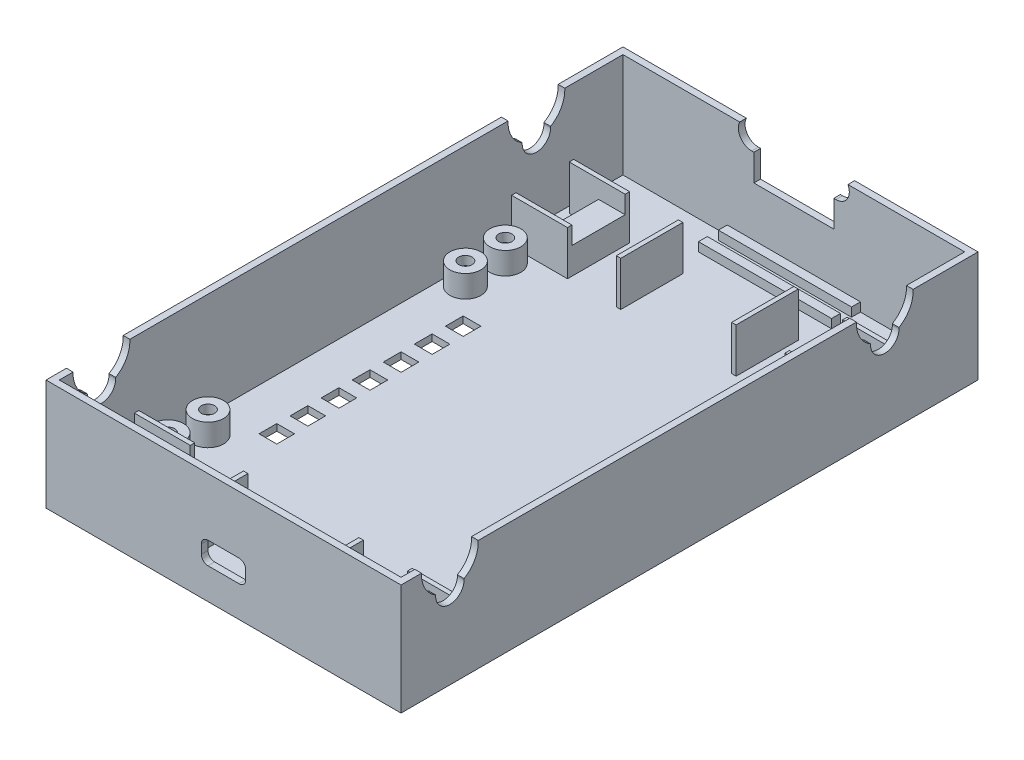
from build123d import *

# Parameters (mm, degrees)
SKETCH_265_W         = 80
SKETCH_265_H         = 130
EXTRUDE_1_DEPTH      = 25
SKETCH_1_W           = 77
SKETCH_1_H           = 127
CUT_EXTRUDE_1_DEPTH  = 23.5
CUT_EXTRUDE_2_DEPTH  = 2
CUT_EXTRUDE_3_DEPTH  = 1.5
CUT_EXTRUDE_4_DEPTH  = 1.5
CUT_EXTRUDE_START    = -1.5
CUT_EXTRUDE_5_DEPTH  = 1.5
CUT_EXTRUDE_7_DEPTH  = 1.5
SKETCH_10_W          = 6
SKETCH_10_H          = 12
EXTRUDE_2_DEPTH      = 6
SKETCH_11_W          = 12.6
SKETCH_11_H          = 1
EXTRUDE_3_DEPTH      = 10
SKETCH_13_R          = 3.5
EXTRUDE_4_DEPTH      = 5
SKETCH_14_R          = 2.5
CUT_EXTRUDE_8_DEPTH  = 4.5
CUT_EXTRUDE_9_REACH  = 80.532
SKETCH_15_R          = 1.5
FILLET_1_R           = 1
CUT_EXTRUDE_10_REACH = 81.858
SKETCH_16_W          = 4
SKETCH_16_H          = 4
CUT_EXTRUDE_12_DEPTH = 1.5
SKETCH_18_W          = 30
SKETCH_18_H          = 2
EXTRUDE_5_DEPTH      = 2
SKETCH_19_W          = 1
SKETCH_19_H          = 14
EXTRUDE_6_DEPTH      = 10


with BuildPart() as part:
    # Sketch 265 → Бобышка-Вытянуть1 (new body)
    with BuildSketch(Plane(origin=(0, 0, 0), x_dir=(1, 0, 0), z_dir=(0, 1, 0))):
        Rectangle(SKETCH_265_W, SKETCH_265_H)
    extrude(amount=EXTRUDE_1_DEPTH)

    # Эскиз1 → Вырез-Вытянуть1 (cut)
    with BuildSketch(Plane(origin=(0, 25, 0), x_dir=(1, 0, 0), z_dir=(0, 1, 0))):
        Rectangle(SKETCH_1_W, SKETCH_1_H)
    extrude(amount=-CUT_EXTRUDE_1_DEPTH, mode=Mode.SUBTRACT)

    # Эскиз2 → Вырез-Вытянуть2 (cut)
    with BuildSketch(Plane.XY.offset(-63.5)):
        with BuildLine():
            Line((-9, 26.7), (-9, 32.7))
            Line((-9, 32.7), (9, 32.7))
            Line((9, 32.7), (9, 26.7))
            Line((9, 26.7), (9.5, 26.7))
            ThreePointArc((9.5, 26.7), (12.5, 23.7), (9.5, 20.7))
            Line((9.5, 20.7), (9, 20.7))
            Line((9, 20.7), (9, 14.7))
            Line((9, 14.7), (-9, 14.7))
            Line((-9, 14.7), (-9, 20.7))
            Line((-9, 20.7), (-9.5, 20.7))
            ThreePointArc((-9.5, 20.7), (-12.5, 23.7), (-9.5, 26.7))
            Line((-9.5, 26.7), (-9, 26.7))
        make_face()
    extrude(amount=-CUT_EXTRUDE_2_DEPTH, mode=Mode.SUBTRACT)

    # Эскиз3 → Вырез-Вытянуть3 (cut)
    with BuildSketch(Plane.ZY.offset(40)):
        with BuildLine():
            Line((-47.2, 18.9), (-47.2, 19.157437416))
            ThreePointArc((-47.2, 19.157437416), (-44, 31.1), (-40.8, 19.157437416))
            Line((-40.8, 19.157437416), (-40.8, 18.9))
            ThreePointArc((-40.8, 18.9), (-44, 15.7), (-47.2, 18.9))
        make_face()
    extrude(amount=-CUT_EXTRUDE_3_DEPTH, mode=Mode.SUBTRACT)

    # Эскиз5 → Вырез-Вытянуть4 (cut)
    with BuildSketch(Plane.ZY.offset(40)):
        with BuildLine():
            Line((50.8, 18.9), (50.8, 19.157437416))
            ThreePointArc((50.8, 19.157437416), (54, 31.1), (57.2, 19.157437416))
            Line((57.2, 19.157437416), (57.2, 18.9))
            ThreePointArc((57.2, 18.9), (54, 15.7), (50.8, 18.9))
        make_face()
    extrude(amount=-CUT_EXTRUDE_4_DEPTH, mode=Mode.SUBTRACT)

    # Эскиз6 → Вырез-Вытянуть5 (cut)
    with BuildSketch(Plane(origin=(40, 0, 0), x_dir=(0, 0, -1), z_dir=(1, 0, 0)).offset(CUT_EXTRUDE_START)):
        with BuildLine():
            Line((-57.2, 18.9), (-57.2, 19.157437416))
            ThreePointArc((-57.2, 19.157437416), (-54, 31.1), (-50.8, 19.157437416))
            Line((-50.8, 19.157437416), (-50.8, 18.9))
            ThreePointArc((-50.8, 18.9), (-54, 15.7), (-57.2, 18.9))
        make_face()
    extrude(amount=CUT_EXTRUDE_5_DEPTH, mode=Mode.SUBTRACT)

    # Эскиз9 → Вырез-Вытянуть7 (cut)
    with BuildSketch(Plane(origin=(40, 0, 0), x_dir=(0, 0, -1), z_dir=(1, 0, 0)).offset(CUT_EXTRUDE_START)):
        with BuildLine():
            Line((40.8, 18.9), (40.8, 19.157437416))
            ThreePointArc((40.8, 19.157437416), (44, 31.1), (47.2, 19.157437416))
            Line((47.2, 19.157437416), (47.2, 18.9))
            ThreePointArc((47.2, 18.9), (44, 15.7), (40.8, 18.9))
        make_face()
    extrude(amount=CUT_EXTRUDE_7_DEPTH, mode=Mode.SUBTRACT)

    # Эскиз10 → Бобышка-Вытянуть2 (add)
    with BuildSketch(Plane(origin=(0, 1.5, 0), x_dir=(1, 0, 0), z_dir=(0, 1, 0))):
        with Locations((-27.5, 44)):
            Rectangle(SKETCH_10_W, SKETCH_10_H)
        with Locations((27.5, 44)):
            Rectangle(SKETCH_10_W, SKETCH_10_H)
        with Locations((-27.5, -54)):
            Rectangle(SKETCH_10_W, SKETCH_10_H)
        with Locations((27.5, -54)):
            Rectangle(SKETCH_10_W, SKETCH_10_H)
    extrude(amount=EXTRUDE_2_DEPTH)

    # Эскиз11 → Бобышка-Вытянуть3 (add)
    with BuildSketch(Plane(origin=(0, 1.5, 0), x_dir=(1, 0, 0), z_dir=(0, 1, 0))):
        with Locations((-30.8, 50.5)):
            Rectangle(SKETCH_11_W, SKETCH_11_H)
        with Locations((30.8, 50.5)):
            Rectangle(SKETCH_11_W, SKETCH_11_H)
        with Locations((-30.8, 37.5)):
            Rectangle(SKETCH_11_W, SKETCH_11_H)
        with Locations((30.8, 37.5)):
            Rectangle(SKETCH_11_W, SKETCH_11_H)
        with Locations((30.8, -47.5)):
            Rectangle(SKETCH_11_W, SKETCH_11_H)
        with Locations((30.8, -60.5)):
            Rectangle(SKETCH_11_W, SKETCH_11_H)
        with Locations((-30.8, -47.5)):
            Rectangle(SKETCH_11_W, SKETCH_11_H)
        with Locations((-30.8, -60.5)):
            Rectangle(SKETCH_11_W, SKETCH_11_H)
    extrude(amount=EXTRUDE_3_DEPTH)

    # Эскиз13 → Бобышка-Вытянуть4 (add)
    with BuildSketch(Plane(origin=(0, 1.5, 0), x_dir=(1, 0, 0), z_dir=(0, 1, 0))):
        with Locations(Location((-34.5, 24, 0), (0, 0, 270))):
            Circle(SKETCH_13_R)
        with Locations(Location((34.5, 24, 0), (0, 0, 270))):
            Circle(SKETCH_13_R)
        with Locations(Location((-34.5, -34, 0), (0, 0, 270))):
            Circle(SKETCH_13_R)
        with Locations(Location((34.5, -34, 0), (0, 0, 270))):
            Circle(SKETCH_13_R)
        with Locations(Location((-34.5, 33, 0), (0, 0, 270))):
            Circle(SKETCH_13_R)
        with Locations(Location((34.5, 33, 0), (0, 0, 270))):
            Circle(SKETCH_13_R)
        with Locations(Location((-34.5, -43, 0), (0, 0, 270))):
            Circle(SKETCH_13_R)
        with Locations(Location((34.5, -43, 0), (0, 0, 270))):
            Circle(SKETCH_13_R)
        with Locations(Location((0, -54, 0), (0, 0, 270))):
            Circle(SKETCH_13_R)
    extrude(amount=EXTRUDE_4_DEPTH)

    # Эскиз14 → Вырез-Вытянуть8 (cut)
    with BuildSketch(Plane.XZ):
        with Locations(Location((-34.5, 34, 0), (0, 0, 270))):
            Circle(SKETCH_14_R)
        with Locations(Location((34.5, 34, 0), (0, 0, 270))):
            Circle(SKETCH_14_R)
        with Locations(Location((-34.5, -24, 0), (0, 0, 270))):
            Circle(SKETCH_14_R)
        with Locations(Location((34.5, -24, 0), (0, 0, 270))):
            Circle(SKETCH_14_R)
        with Locations(Location((-34.5, -33, 0), (0, 0, 270))):
            Circle(SKETCH_14_R)
        with Locations(Location((34.5, -33, 0), (0, 0, 270))):
            Circle(SKETCH_14_R)
        with Locations(Location((34.5, 43, 0), (0, 0, 270))):
            Circle(SKETCH_14_R)
        with Locations(Location((-34.5, 43, 0), (0, 0, 270))):
            Circle(SKETCH_14_R)
        with Locations(Location((0, 54, 0), (0, 0, 270))):
            Circle(SKETCH_14_R)
    extrude(amount=-CUT_EXTRUDE_8_DEPTH, mode=Mode.SUBTRACT)

    # Эскиз15 → Вырез-Вытянуть9 (cut, up to next)
    with BuildSketch(Plane(origin=(0, 6.5, 0), x_dir=(1, 0, 0), z_dir=(0, 1, 0)), mode=Mode.PRIVATE) as cut_extrude_9_sk1:
        with Locations(Location((-34.5, 24, 0), (0, 0, 270))):
            Circle(SKETCH_15_R)
    cut_extrude_9_tool1 = extrude(cut_extrude_9_sk1.sketch, amount=-CUT_EXTRUDE_9_REACH, mode=Mode.PRIVATE) & part.part
    # Эскиз15 → Вырез-Вытянуть9 (cut, up to next)
    with BuildSketch(Plane(origin=(0, 6.5, 0), x_dir=(1, 0, 0), z_dir=(0, 1, 0)), mode=Mode.PRIVATE) as cut_extrude_9_sk2:
        with Locations(Location((34.5, 24, 0), (0, 0, 270))):
            Circle(SKETCH_15_R)
    cut_extrude_9_tool2 = extrude(cut_extrude_9_sk2.sketch, amount=-CUT_EXTRUDE_9_REACH, mode=Mode.PRIVATE) & part.part
    # Эскиз15 → Вырез-Вытянуть9 (cut, up to next)
    with BuildSketch(Plane(origin=(0, 6.5, 0), x_dir=(1, 0, 0), z_dir=(0, 1, 0)), mode=Mode.PRIVATE) as cut_extrude_9_sk3:
        with Locations(Location((-34.5, -34, 0), (0, 0, 270))):
            Circle(SKETCH_15_R)
    cut_extrude_9_tool3 = extrude(cut_extrude_9_sk3.sketch, amount=-CUT_EXTRUDE_9_REACH, mode=Mode.PRIVATE) & part.part
    # Эскиз15 → Вырез-Вытянуть9 (cut, up to next)
    with BuildSketch(Plane(origin=(0, 6.5, 0), x_dir=(1, 0, 0), z_dir=(0, 1, 0)), mode=Mode.PRIVATE) as cut_extrude_9_sk4:
        with Locations(Location((34.5, -34, 0), (0, 0, 270))):
            Circle(SKETCH_15_R)
    cut_extrude_9_tool4 = extrude(cut_extrude_9_sk4.sketch, amount=-CUT_EXTRUDE_9_REACH, mode=Mode.PRIVATE) & part.part
    # Эскиз15 → Вырез-Вытянуть9 (cut, up to next)
    with BuildSketch(Plane(origin=(0, 6.5, 0), x_dir=(1, 0, 0), z_dir=(0, 1, 0)), mode=Mode.PRIVATE) as cut_extrude_9_sk5:
        with Locations(Location((-34.5, 33, 0), (0, 0, 270))):
            Circle(SKETCH_15_R)
    cut_extrude_9_tool5 = extrude(cut_extrude_9_sk5.sketch, amount=-CUT_EXTRUDE_9_REACH, mode=Mode.PRIVATE) & part.part
    # Эскиз15 → Вырез-Вытянуть9 (cut, up to next)
    with BuildSketch(Plane(origin=(0, 6.5, 0), x_dir=(1, 0, 0), z_dir=(0, 1, 0)), mode=Mode.PRIVATE) as cut_extrude_9_sk6:
        with Locations(Location((34.5, 33, 0), (0, 0, 270))):
            Circle(SKETCH_15_R)
    cut_extrude_9_tool6 = extrude(cut_extrude_9_sk6.sketch, amount=-CUT_EXTRUDE_9_REACH, mode=Mode.PRIVATE) & part.part
    # Эскиз15 → Вырез-Вытянуть9 (cut, up to next)
    with BuildSketch(Plane(origin=(0, 6.5, 0), x_dir=(1, 0, 0), z_dir=(0, 1, 0)), mode=Mode.PRIVATE) as cut_extrude_9_sk7:
        with Locations(Location((-34.5, -43, 0), (0, 0, 270))):
            Circle(SKETCH_15_R)
    cut_extrude_9_tool7 = extrude(cut_extrude_9_sk7.sketch, amount=-CUT_EXTRUDE_9_REACH, mode=Mode.PRIVATE) & part.part
    # Эскиз15 → Вырез-Вытянуть9 (cut, up to next)
    with BuildSketch(Plane(origin=(0, 6.5, 0), x_dir=(1, 0, 0), z_dir=(0, 1, 0)), mode=Mode.PRIVATE) as cut_extrude_9_sk8:
        with Locations(Location((34.5, -43, 0), (0, 0, 270))):
            Circle(SKETCH_15_R)
    cut_extrude_9_tool8 = extrude(cut_extrude_9_sk8.sketch, amount=-CUT_EXTRUDE_9_REACH, mode=Mode.PRIVATE) & part.part
    # Эскиз15 → Вырез-Вытянуть9 (cut, up to next)
    with BuildSketch(Plane(origin=(0, 6.5, 0), x_dir=(1, 0, 0), z_dir=(0, 1, 0)), mode=Mode.PRIVATE) as cut_extrude_9_sk9:
        with Locations(Location((0, -54, 0), (0, 0, 270))):
            Circle(SKETCH_15_R)
    cut_extrude_9_tool9 = extrude(cut_extrude_9_sk9.sketch, amount=-CUT_EXTRUDE_9_REACH, mode=Mode.PRIVATE) & part.part
    add(cut_extrude_9_tool1.solids().sort_by_distance((-34.5, 6.5, -24))[0], mode=Mode.SUBTRACT)
    add(cut_extrude_9_tool2.solids().sort_by_distance((34.5, 6.5, -24))[0], mode=Mode.SUBTRACT)
    add(cut_extrude_9_tool3.solids().sort_by_distance((-34.5, 6.5, 34))[0], mode=Mode.SUBTRACT)
    add(cut_extrude_9_tool4.solids().sort_by_distance((34.5, 6.5, 34))[0], mode=Mode.SUBTRACT)
    add(cut_extrude_9_tool5.solids().sort_by_distance((-34.5, 6.5, -33))[0], mode=Mode.SUBTRACT)
    add(cut_extrude_9_tool6.solids().sort_by_distance((34.5, 6.5, -33))[0], mode=Mode.SUBTRACT)
    add(cut_extrude_9_tool7.solids().sort_by_distance((-34.5, 6.5, 43))[0], mode=Mode.SUBTRACT)
    add(cut_extrude_9_tool8.solids().sort_by_distance((34.5, 6.5, 43))[0], mode=Mode.SUBTRACT)
    add(cut_extrude_9_tool9.solids().sort_by_distance((0, 6.5, 54))[0], mode=Mode.SUBTRACT)

    # Скругление1
    fillet_1_edges = [part.edges().sort_by_distance(p)[0] for p in [
        (0, 0, 56.5),
        (-34.5, 0, 45.5),
        (34.5, 0, 45.5),
        (34.5, 0, -30.5),
        (-34.5, 0, -30.5),
        (34.5, 0, -21.5),
        (-34.5, 0, -21.5),
        (34.5, 0, 36.5),
        (-34.5, 0, 36.5),
    ]]
    fillet(fillet_1_edges, radius=FILLET_1_R)

    # Эскиз16 → Вырез-Вытянуть10 (cut, up to next)
    with BuildSketch(Plane(origin=(0, 1.5, 0), x_dir=(1, 0, 0), z_dir=(0, 1, 0)), mode=Mode.PRIVATE) as cut_extrude_10_sk1:
        with Locations((-27, 9)):
            Rectangle(SKETCH_16_W, SKETCH_16_H)
    cut_extrude_10_tool1 = extrude(cut_extrude_10_sk1.sketch, amount=-CUT_EXTRUDE_10_REACH, mode=Mode.PRIVATE) & part.part
    # Эскиз16 → Вырез-Вытянуть10 (cut, up to next)
    with BuildSketch(Plane(origin=(0, 1.5, 0), x_dir=(1, 0, 0), z_dir=(0, 1, 0)), mode=Mode.PRIVATE) as cut_extrude_10_sk2:
        with Locations((-27, 16)):
            Rectangle(SKETCH_16_W, SKETCH_16_H)
    cut_extrude_10_tool2 = extrude(cut_extrude_10_sk2.sketch, amount=-CUT_EXTRUDE_10_REACH, mode=Mode.PRIVATE) & part.part
    # Эскиз16 → Вырез-Вытянуть10 (cut, up to next)
    with BuildSketch(Plane(origin=(0, 1.5, 0), x_dir=(1, 0, 0), z_dir=(0, 1, 0)), mode=Mode.PRIVATE) as cut_extrude_10_sk3:
        with Locations((-27, -5)):
            Rectangle(SKETCH_16_W, SKETCH_16_H)
    cut_extrude_10_tool3 = extrude(cut_extrude_10_sk3.sketch, amount=-CUT_EXTRUDE_10_REACH, mode=Mode.PRIVATE) & part.part
    # Эскиз16 → Вырез-Вытянуть10 (cut, up to next)
    with BuildSketch(Plane(origin=(0, 1.5, 0), x_dir=(1, 0, 0), z_dir=(0, 1, 0)), mode=Mode.PRIVATE) as cut_extrude_10_sk4:
        with Locations((-27, 2)):
            Rectangle(SKETCH_16_W, SKETCH_16_H)
    cut_extrude_10_tool4 = extrude(cut_extrude_10_sk4.sketch, amount=-CUT_EXTRUDE_10_REACH, mode=Mode.PRIVATE) & part.part
    # Эскиз16 → Вырез-Вытянуть10 (cut, up to next)
    with BuildSketch(Plane(origin=(0, 1.5, 0), x_dir=(1, 0, 0), z_dir=(0, 1, 0)), mode=Mode.PRIVATE) as cut_extrude_10_sk5:
        with Locations((-27, -19)):
            Rectangle(SKETCH_16_W, SKETCH_16_H)
    cut_extrude_10_tool5 = extrude(cut_extrude_10_sk5.sketch, amount=-CUT_EXTRUDE_10_REACH, mode=Mode.PRIVATE) & part.part
    # Эскиз16 → Вырез-Вытянуть10 (cut, up to next)
    with BuildSketch(Plane(origin=(0, 1.5, 0), x_dir=(1, 0, 0), z_dir=(0, 1, 0)), mode=Mode.PRIVATE) as cut_extrude_10_sk6:
        with Locations((-27, -12)):
            Rectangle(SKETCH_16_W, SKETCH_16_H)
    cut_extrude_10_tool6 = extrude(cut_extrude_10_sk6.sketch, amount=-CUT_EXTRUDE_10_REACH, mode=Mode.PRIVATE) & part.part
    # Эскиз16 → Вырез-Вытянуть10 (cut, up to next)
    with BuildSketch(Plane(origin=(0, 1.5, 0), x_dir=(1, 0, 0), z_dir=(0, 1, 0)), mode=Mode.PRIVATE) as cut_extrude_10_sk7:
        with Locations((-27, -26)):
            Rectangle(SKETCH_16_W, SKETCH_16_H)
    cut_extrude_10_tool7 = extrude(cut_extrude_10_sk7.sketch, amount=-CUT_EXTRUDE_10_REACH, mode=Mode.PRIVATE) & part.part
    # Эскиз16 → Вырез-Вытянуть10 (cut, up to next)
    with BuildSketch(Plane(origin=(0, 1.5, 0), x_dir=(1, 0, 0), z_dir=(0, 1, 0)), mode=Mode.PRIVATE) as cut_extrude_10_sk8:
        with Locations((27, -26)):
            Rectangle(SKETCH_16_W, SKETCH_16_H)
    cut_extrude_10_tool8 = extrude(cut_extrude_10_sk8.sketch, amount=-CUT_EXTRUDE_10_REACH, mode=Mode.PRIVATE) & part.part
    # Эскиз16 → Вырез-Вытянуть10 (cut, up to next)
    with BuildSketch(Plane(origin=(0, 1.5, 0), x_dir=(1, 0, 0), z_dir=(0, 1, 0)), mode=Mode.PRIVATE) as cut_extrude_10_sk9:
        with Locations((27, -19)):
            Rectangle(SKETCH_16_W, SKETCH_16_H)
    cut_extrude_10_tool9 = extrude(cut_extrude_10_sk9.sketch, amount=-CUT_EXTRUDE_10_REACH, mode=Mode.PRIVATE) & part.part
    # Эскиз16 → Вырез-Вытянуть10 (cut, up to next)
    with BuildSketch(Plane(origin=(0, 1.5, 0), x_dir=(1, 0, 0), z_dir=(0, 1, 0)), mode=Mode.PRIVATE) as cut_extrude_10_sk10:
        with Locations((27, -12)):
            Rectangle(SKETCH_16_W, SKETCH_16_H)
    cut_extrude_10_tool10 = extrude(cut_extrude_10_sk10.sketch, amount=-CUT_EXTRUDE_10_REACH, mode=Mode.PRIVATE) & part.part
    # Эскиз16 → Вырез-Вытянуть10 (cut, up to next)
    with BuildSketch(Plane(origin=(0, 1.5, 0), x_dir=(1, 0, 0), z_dir=(0, 1, 0)), mode=Mode.PRIVATE) as cut_extrude_10_sk11:
        with Locations((27, -5)):
            Rectangle(SKETCH_16_W, SKETCH_16_H)
    cut_extrude_10_tool11 = extrude(cut_extrude_10_sk11.sketch, amount=-CUT_EXTRUDE_10_REACH, mode=Mode.PRIVATE) & part.part
    # Эскиз16 → Вырез-Вытянуть10 (cut, up to next)
    with BuildSketch(Plane(origin=(0, 1.5, 0), x_dir=(1, 0, 0), z_dir=(0, 1, 0)), mode=Mode.PRIVATE) as cut_extrude_10_sk12:
        with Locations((27, 2)):
            Rectangle(SKETCH_16_W, SKETCH_16_H)
    cut_extrude_10_tool12 = extrude(cut_extrude_10_sk12.sketch, amount=-CUT_EXTRUDE_10_REACH, mode=Mode.PRIVATE) & part.part
    # Эскиз16 → Вырез-Вытянуть10 (cut, up to next)
    with BuildSketch(Plane(origin=(0, 1.5, 0), x_dir=(1, 0, 0), z_dir=(0, 1, 0)), mode=Mode.PRIVATE) as cut_extrude_10_sk13:
        with Locations((27, 9)):
            Rectangle(SKETCH_16_W, SKETCH_16_H)
    cut_extrude_10_tool13 = extrude(cut_extrude_10_sk13.sketch, amount=-CUT_EXTRUDE_10_REACH, mode=Mode.PRIVATE) & part.part
    # Эскиз16 → Вырез-Вытянуть10 (cut, up to next)
    with BuildSketch(Plane(origin=(0, 1.5, 0), x_dir=(1, 0, 0), z_dir=(0, 1, 0)), mode=Mode.PRIVATE) as cut_extrude_10_sk14:
        with Locations((27, 16)):
            Rectangle(SKETCH_16_W, SKETCH_16_H)
    cut_extrude_10_tool14 = extrude(cut_extrude_10_sk14.sketch, amount=-CUT_EXTRUDE_10_REACH, mode=Mode.PRIVATE) & part.part
    add(cut_extrude_10_tool1.solids().sort_by_distance((-27, 1.5, -9))[0], mode=Mode.SUBTRACT)
    add(cut_extrude_10_tool2.solids().sort_by_distance((-27, 1.5, -16))[0], mode=Mode.SUBTRACT)
    add(cut_extrude_10_tool3.solids().sort_by_distance((-27, 1.5, 5))[0], mode=Mode.SUBTRACT)
    add(cut_extrude_10_tool4.solids().sort_by_distance((-27, 1.5, -2))[0], mode=Mode.SUBTRACT)
    add(cut_extrude_10_tool5.solids().sort_by_distance((-27, 1.5, 19))[0], mode=Mode.SUBTRACT)
    add(cut_extrude_10_tool6.solids().sort_by_distance((-27, 1.5, 12))[0], mode=Mode.SUBTRACT)
    add(cut_extrude_10_tool7.solids().sort_by_distance((-27, 1.5, 26))[0], mode=Mode.SUBTRACT)
    add(cut_extrude_10_tool8.solids().sort_by_distance((27, 1.5, 26))[0], mode=Mode.SUBTRACT)
    add(cut_extrude_10_tool9.solids().sort_by_distance((27, 1.5, 19))[0], mode=Mode.SUBTRACT)
    add(cut_extrude_10_tool10.solids().sort_by_distance((27, 1.5, 12))[0], mode=Mode.SUBTRACT)
    add(cut_extrude_10_tool11.solids().sort_by_distance((27, 1.5, 5))[0], mode=Mode.SUBTRACT)
    add(cut_extrude_10_tool12.solids().sort_by_distance((27, 1.5, -2))[0], mode=Mode.SUBTRACT)
    add(cut_extrude_10_tool13.solids().sort_by_distance((27, 1.5, -9))[0], mode=Mode.SUBTRACT)
    add(cut_extrude_10_tool14.solids().sort_by_distance((27, 1.5, -16))[0], mode=Mode.SUBTRACT)

    # Эскиз17 → Вырез-Вытянуть12 (cut)
    with BuildSketch(Plane.XY.offset(65)):
        with BuildLine():
            Line((-3.5, 12), (3.5, 12))
            ThreePointArc((3.5, 12), (4.560660172, 11.560660172), (5, 10.5))
            Line((5, 10.5), (5, 8.5))
            ThreePointArc((5, 8.5), (4.560660172, 7.439339828), (3.5, 7))
            Line((3.5, 7), (-3.5, 7))
            ThreePointArc((-3.5, 7), (-4.560660172, 7.439339828), (-5, 8.5))
            Line((-5, 8.5), (-5, 10.5))
            ThreePointArc((-5, 10.5), (-4.560660172, 11.560660172), (-3.5, 12))
        make_face()
    extrude(amount=-CUT_EXTRUDE_12_DEPTH, mode=Mode.SUBTRACT)

    # Эскиз18 → Бобышка-Вытянуть5 (add)
    with BuildSketch(Plane(origin=(0, 1.5, 0), x_dir=(1, 0, 0), z_dir=(0, 1, 0))):
        with Locations((0, 62.5)):
            Rectangle(SKETCH_18_W, SKETCH_18_H)
        with Locations((0, 58)):
            Rectangle(SKETCH_18_W, SKETCH_18_H)
    extrude(amount=EXTRUDE_5_DEPTH)

    # Эскиз19 → Бобышка-Вытянуть6 (add)
    with BuildSketch(Plane(origin=(0, 1.5, 0), x_dir=(1, 0, 0), z_dir=(0, 1, 0))):
        with Locations((-13, 44)):
            Rectangle(SKETCH_19_W, SKETCH_19_H)
        with Locations((13, 44)):
            Rectangle(SKETCH_19_W, SKETCH_19_H)
        with Locations((-13, -54)):
            Rectangle(SKETCH_19_W, SKETCH_19_H)
        with Locations((13, -54)):
            Rectangle(SKETCH_19_W, SKETCH_19_H)
    extrude(amount=EXTRUDE_6_DEPTH)


solid = part.part
